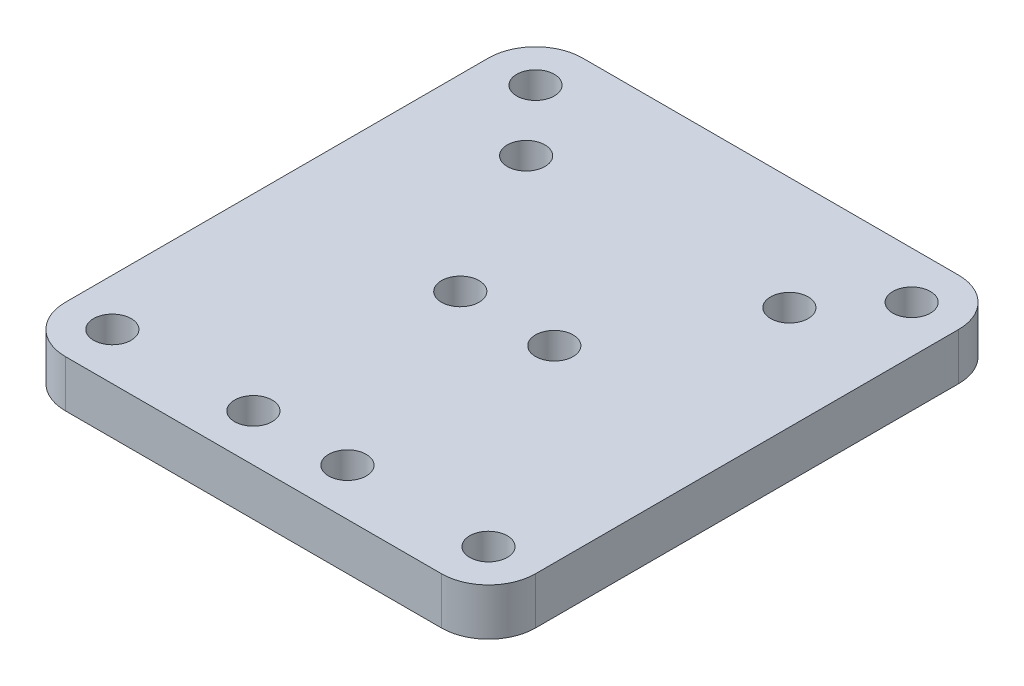
from build123d import *

# Parameters (mm, degrees)
ESQUISSE1_W             = 50
ESQUISSE1_H             = 55
ESQUISSE1_R             = 2
BOSS_EXTRU_1_DEPTH      = 5
CONG_1_R                = 5
ESQUISSE2_R             = 2
ENL_V_MAT_EXTRU_1_DEPTH = 10


with BuildPart() as part:
    # Esquisse1 → Boss.-Extru.1 (new body)
    with BuildSketch(Plane(origin=(0, 0, 0), x_dir=(1, 0, 0), z_dir=(0, 1, 0))):
        Rectangle(ESQUISSE1_W, ESQUISSE1_H)
        with Locations(Location((-5, -22.5, 0), (0, 0, 270))):
            Circle(ESQUISSE1_R, mode=Mode.SUBTRACT)
        with Locations(Location((5, -22.5, 0), (0, 0, 270))):
            Circle(ESQUISSE1_R, mode=Mode.SUBTRACT)
        with Locations(Location((-5, -0.5, 0), (0, 0, 270))):
            Circle(ESQUISSE1_R, mode=Mode.SUBTRACT)
        with Locations(Location((5, -0.5, 0), (0, 0, 270))):
            Circle(ESQUISSE1_R, mode=Mode.SUBTRACT)
    extrude(amount=BOSS_EXTRU_1_DEPTH)

    # Congé1
    cong_1_edges = [part.edges().sort_by_distance(p)[0] for p in [
        (-25, 2.5, -27.5),
        (25, 2.5, -27.5),
        (25, 2.5, 27.5),
        (-25, 2.5, 27.5),
    ]]
    fillet(cong_1_edges, radius=CONG_1_R)

    # Esquisse2 → Enlèv. mat.-Extru.1 (cut)
    with BuildSketch(Plane(origin=(0, 5, 0), x_dir=(1, 0, 0), z_dir=(0, 1, 0))):
        with Locations(Location((-20, 22.5, 0), (0, 0, 270))):
            Circle(ESQUISSE2_R)
        with Locations(Location((-20, -22.5, 0), (0, 0, 270))):
            Circle(ESQUISSE2_R)
        with Locations(Location((20, -22.5, 0), (0, 0, 270))):
            Circle(ESQUISSE2_R)
        with Locations(Location((20, 22.5, 0), (0, 0, 270))):
            Circle(ESQUISSE2_R)
        with Locations(Location((-14, 15.5, 0), (0, 0, 270))):
            Circle(ESQUISSE2_R)
        with Locations(Location((14, 15.5, 0), (0, 0, 270))):
            Circle(ESQUISSE2_R)
    extrude(amount=-ENL_V_MAT_EXTRU_1_DEPTH, mode=Mode.SUBTRACT)


solid = part.part
